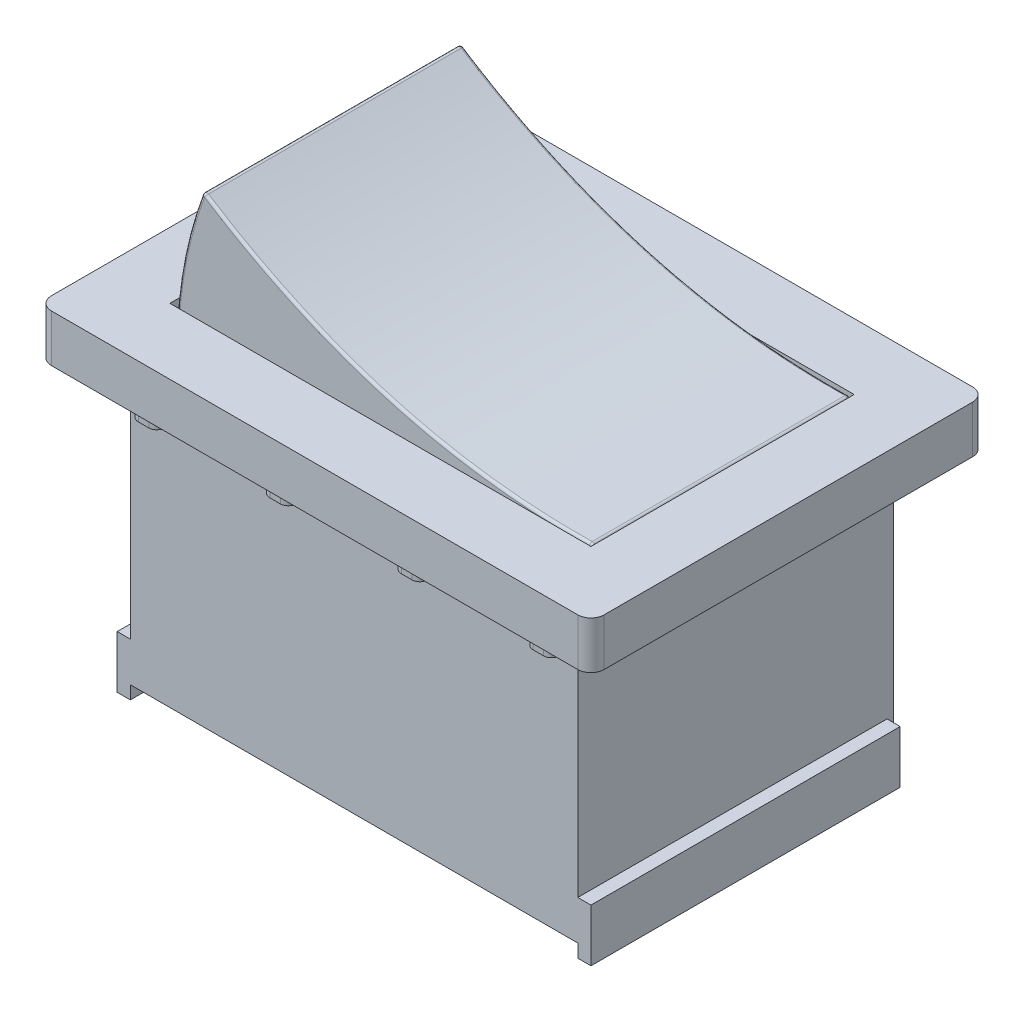
from build123d import *

# Parameters (mm, degrees)
SALIENTE_EXTRUIR1_DEPTH      = 1.8
CROQUIS2_W                   = 16
CROQUIS2_H                   = 10
CORTAR_EXTRUIR1_DEPTH        = 1.5
SALIENTE_EXTRUIR3_DEPTH      = 4.9
SALIENTE_EXTRUIR3_DEPTH_BACK = 4.9
CROQUIS4_W                   = 0.05
CROQUIS4_H                   = 10
CORTAR_EXTRUIR2_DEPTH        = 1.7
REDONDEO1_R                  = 0.1
REDONDEO2_R                  = 0.1
CROQUIS5_W                   = 17
CROQUIS5_H                   = 12
SALIENTE_EXTRUIR4_DEPTH      = 10.5
SALIENTE_EXTRUIR5_DEPTH      = 1.2
CROQUIS7_W                   = 11.75
CROQUIS7_H                   = 2
SALIENTE_EXTRUIR6_DEPTH      = 0.5
CROQUIS8_W                   = 12
CROQUIS8_H                   = 2
SALIENTE_EXTRUIR7_DEPTH      = 0.5


with BuildPart() as part:
    # Croquis1 → Saliente-Extruir1 (new body)
    with BuildSketch(Plane(origin=(0, 0, 0), x_dir=(1, 0, 0), z_dir=(0, 1, 0))):
        with BuildLine():
            Line((-10, -7.5), (10, -7.5))
            ThreePointArc((10, -7.5), (10.353553391, -7.353553391), (10.5, -7))
            Line((10.5, -7), (10.5, 7))
            ThreePointArc((10.5, 7), (10.353553391, 7.353553391), (10, 7.5))
            Line((10, 7.5), (-10, 7.5))
            ThreePointArc((-10, 7.5), (-10.353553391, 7.353553391), (-10.5, 7))
            Line((-10.5, 7), (-10.5, -7))
            ThreePointArc((-10.5, -7), (-10.353553391, -7.353553391), (-10, -7.5))
        make_face()
    extrude(amount=SALIENTE_EXTRUIR1_DEPTH)

    # Croquis2 → Cortar-Extruir1 (cut)
    with BuildSketch(Plane(origin=(0, 1.8, 0), x_dir=(1, 0, 0), z_dir=(0, 1, 0))):
        Rectangle(CROQUIS2_W, CROQUIS2_H)
    extrude(amount=-CORTAR_EXTRUIR1_DEPTH, mode=Mode.SUBTRACT)

    # Croquis3 → Saliente-Extruir3 (add, two sides: drawn at the far end of the back side and taken through both)
    with BuildSketch(Plane.XY.offset(-SALIENTE_EXTRUIR3_DEPTH_BACK)):
        with BuildLine():
            Line((8.046935069, 1.793629428), (8.088403313, 0.3))
            Line((8.088403313, 0.3), (-7.875, 0.3))
            ThreePointArc((-7.875, 0.3), (-7.612603193, 3.197144273), (-6.833952566, 6))
            add(Edge.make_bspline(
                [(-6.833952566, 6), (-2.282486721, 3.046687717), (2.677809157, 1.644564193), (8.046935069, 1.793629428)],
                knots=[0, 0, 0, 0, 0.987561785, 0.987561785, 0.987561785, 0.987561785], degree=3))
        make_face()
    extrude(amount=SALIENTE_EXTRUIR3_DEPTH + SALIENTE_EXTRUIR3_DEPTH_BACK)

    # Croquis4 → Cortar-Extruir2 (cut)
    with BuildSketch(Plane(origin=(0, 1.8, 0), x_dir=(1, 0, 0), z_dir=(0, 1, 0))):
        with Locations((7.975, 0)):
            Rectangle(CROQUIS4_W, CROQUIS4_H)
    extrude(amount=-CORTAR_EXTRUIR2_DEPTH, mode=Mode.SUBTRACT)

    # Redondeo1
    redondeo1_edges = [part.edges().sort_by_distance(p)[0] for p in [
        (7.95, 1.791105638, -2.45),
    ]]
    fillet(redondeo1_edges, radius=REDONDEO1_R)

    # Redondeo2
    redondeo2_edges = [part.edges().sort_by_distance(p)[0] for p in [
        (-6.833952566, 6, -2.45),
        (-7.612603193, 3.197144273, 4.9),
        (-7.612603193, 3.197144273, -4.9),
        (7.95, 0.994416132, 4.9),
        (7.95, 0.994416132, -4.9),
        (0.184059834, 2.766462, 4.9),
        (7.919976694, 1.760269386, 4.9),
        (0.184059834, 2.766462, -4.9),
        (7.919976694, 1.760269386, -4.9),
    ]]
    fillet(redondeo2_edges, radius=REDONDEO2_R)

    # Croquis5 → Saliente-Extruir4 (add)
    with BuildSketch(Plane.XZ):
        Rectangle(CROQUIS5_W, CROQUIS5_H)
    extrude(amount=SALIENTE_EXTRUIR4_DEPTH)

    # Croquis6 → Saliente-Extruir5 (add)
    with BuildSketch(Plane.XZ):
        with BuildLine():
            Line((-8, 6), (-7, 6))
            Line((-7, 6), (-7, 6.2))
            ThreePointArc((-7, 6.2), (-7.087867966, 6.412132034), (-7.3, 6.5))
            Line((-7.3, 6.5), (-7.7, 6.5))
            ThreePointArc((-7.7, 6.5), (-7.912132034, 6.412132034), (-8, 6.2))
            Line((-8, 6.2), (-8, 6))
        make_face()
        with BuildLine():
            Line((-3, 6), (-2, 6))
            Line((-2, 6), (-2, 6.2))
            ThreePointArc((-2, 6.2), (-2.087867966, 6.412132034), (-2.3, 6.5))
            Line((-2.3, 6.5), (-2.7, 6.5))
            ThreePointArc((-2.7, 6.5), (-2.912132034, 6.412132034), (-3, 6.2))
            Line((-3, 6.2), (-3, 6))
        make_face()
        with BuildLine():
            Line((2, 6.2), (2, 6))
            Line((2, 6), (3, 6))
            Line((3, 6), (3, 6.2))
            ThreePointArc((3, 6.2), (2.912132034, 6.412132034), (2.7, 6.5))
            Line((2.7, 6.5), (2.3, 6.5))
            ThreePointArc((2.3, 6.5), (2.087867966, 6.412132034), (2, 6.2))
        make_face()
        with BuildLine():
            Line((7, 6.2), (7, 6))
            Line((7, 6), (8, 6))
            Line((8, 6), (8, 6.2))
            ThreePointArc((8, 6.2), (7.912132034, 6.412132034), (7.7, 6.5))
            Line((7.7, 6.5), (7.3, 6.5))
            ThreePointArc((7.3, 6.5), (7.087867966, 6.412132034), (7, 6.2))
        make_face()
        with BuildLine():
            Line((3, -6), (2, -6))
            Line((2, -6), (2, -6.2))
            ThreePointArc((2, -6.2), (2.087867966, -6.412132034), (2.3, -6.5))
            Line((2.3, -6.5), (2.7, -6.5))
            ThreePointArc((2.7, -6.5), (2.912132034, -6.412132034), (3, -6.2))
            Line((3, -6.2), (3, -6))
        make_face()
        with BuildLine():
            Line((8, -6), (7, -6))
            Line((7, -6), (7, -6.2))
            ThreePointArc((7, -6.2), (7.087867966, -6.412132034), (7.3, -6.5))
            Line((7.3, -6.5), (7.7, -6.5))
            ThreePointArc((7.7, -6.5), (7.912132034, -6.412132034), (8, -6.2))
            Line((8, -6.2), (8, -6))
        make_face()
        with BuildLine():
            Line((-2, -6), (-3, -6))
            Line((-3, -6), (-3, -6.2))
            ThreePointArc((-3, -6.2), (-2.912132034, -6.412132034), (-2.7, -6.5))
            Line((-2.7, -6.5), (-2.3, -6.5))
            ThreePointArc((-2.3, -6.5), (-2.087867966, -6.412132034), (-2, -6.2))
            Line((-2, -6.2), (-2, -6))
        make_face()
        with BuildLine():
            Line((-7, -6), (-8, -6))
            Line((-8, -6), (-8, -6.2))
            ThreePointArc((-8, -6.2), (-7.912132034, -6.412132034), (-7.7, -6.5))
            Line((-7.7, -6.5), (-7.3, -6.5))
            ThreePointArc((-7.3, -6.5), (-7.087867966, -6.412132034), (-7, -6.2))
            Line((-7, -6.2), (-7, -6))
        make_face()
    extrude(amount=SALIENTE_EXTRUIR5_DEPTH)

    # Croquis7 → Saliente-Extruir6 (add)
    with BuildSketch(Plane(origin=(8.5, 0, 0), x_dir=(0, 0, -1), z_dir=(1, 0, 0))):
        with Locations((-0.125, -10)):
            Rectangle(CROQUIS7_W, CROQUIS7_H)
    extrude(amount=SALIENTE_EXTRUIR6_DEPTH)

    # Croquis8 → Saliente-Extruir7 (add)
    with BuildSketch(Plane.ZY.offset(8.5)):
        with Locations((0, -10)):
            Rectangle(CROQUIS8_W, CROQUIS8_H)
    extrude(amount=SALIENTE_EXTRUIR7_DEPTH)


solid = part.part
